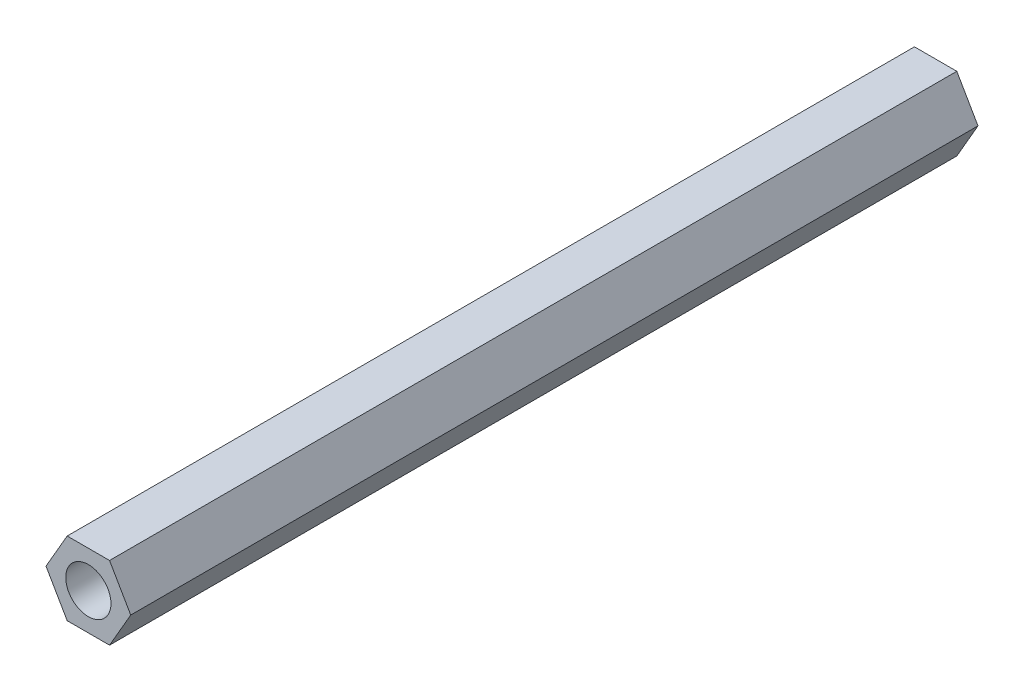
from build123d import *

# Parameters (mm, degrees)
SKETCH_1_R      = 1.6
EXTRUDE_1_DEPTH = 60


with BuildPart() as part:
    # 草图1 → 凸台-拉伸1 (new body)
    with BuildSketch(Plane.XY):
        Polygon((3, 0), (1.5, 2.598076211), (-1.5, 2.598076211), (-3, 0), (-1.5, -2.598076211), (1.5, -2.598076211), align=None)
        Circle(SKETCH_1_R, mode=Mode.SUBTRACT)
    extrude(amount=EXTRUDE_1_DEPTH)


solid = part.part
